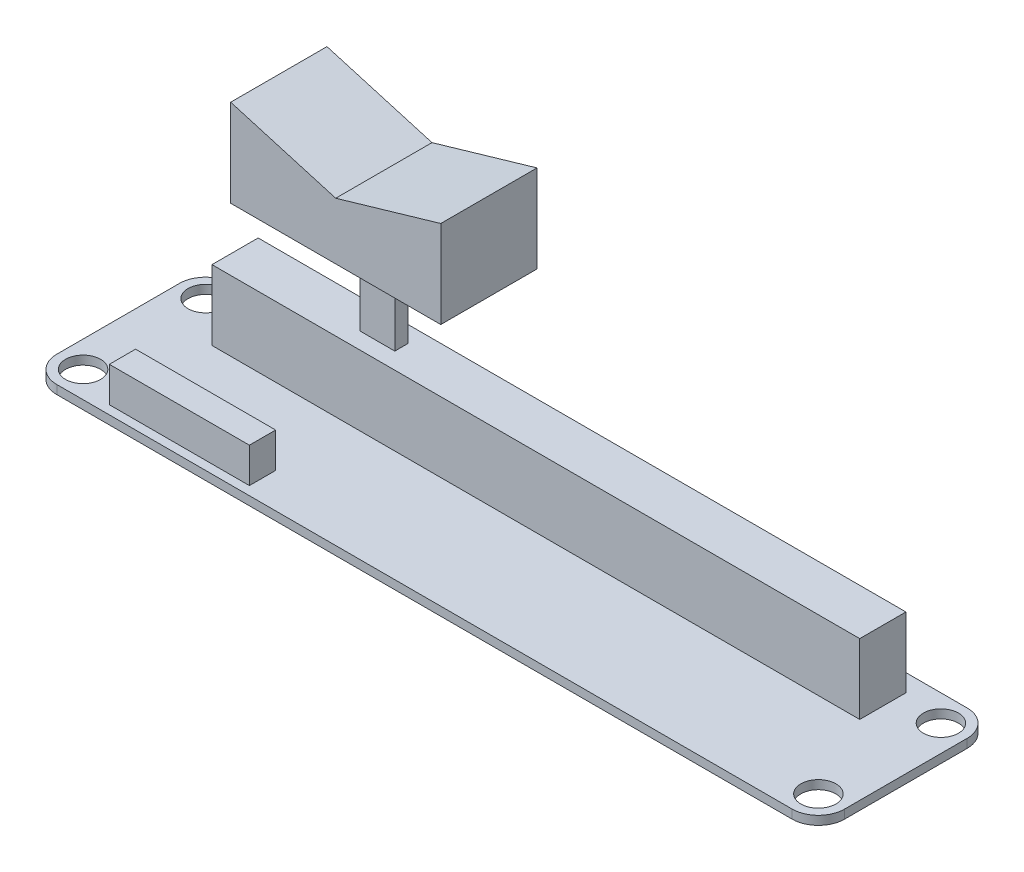
from build123d import *

# Parameters (mm, degrees)
SKETCH1_W           = 90
SKETCH1_H           = 20
BOSS_EXTRUDE1_DEPTH = 1
SKETCH2_R           = 2
CUT_EXTRUDE1_DEPTH  = 93.200867675
FILLET1_R           = 3
SKETCH3_W           = 74
SKETCH3_H           = 5.275339083
BOSS_EXTRUDE2_DEPTH = 8
SKETCH4_W           = 16
SKETCH4_H           = 3
BOSS_EXTRUDE3_DEPTH = 4
SKETCH5_W           = 4
SKETCH5_H           = 1.5
BOSS_EXTRUDE4_DEPTH = 10
SKETCH6_W           = 24
SKETCH6_H           = 11
BOSS_EXTRUDE5_DEPTH = 10
CUT_EXTRUDE2_DEPTH  = 96.194537658


with BuildPart() as part:
    # Sketch1 → Boss-Extrude1 (new body)
    with BuildSketch(Plane(origin=(0, 0, 0), x_dir=(1, 0, 0), z_dir=(0, 1, 0))):
        with Locations((45, 10)):
            Rectangle(SKETCH1_W, SKETCH1_H)
    extrude(amount=BOSS_EXTRUDE1_DEPTH)

    # Sketch2 → Cut-Extrude1 (cut, through all)
    with BuildSketch(Plane(origin=(0, 1, 0), x_dir=(1, 0, 0), z_dir=(0, 1, 0))):
        with Locations(Location((3, 17, 0), (0, 0, 270))):
            Circle(SKETCH2_R)
        with Locations(Location((87, 17, 0), (0, 0, 90))):
            Circle(SKETCH2_R)
        with Locations(Location((87, 3, 0), (0, 0, 270))):
            Circle(SKETCH2_R)
        with Locations(Location((3, 3, 0), (0, 0, 90))):
            Circle(SKETCH2_R)
    extrude(amount=-CUT_EXTRUDE1_DEPTH, mode=Mode.SUBTRACT)

    # Fillet1
    fillet1_edges = [part.edges().sort_by_distance(p)[0] for p in [
        (0, 0.5, -20),
        (90, 0.5, -20),
        (90, 0.5, 0),
        (0, 0.5, 0),
    ]]
    fillet(fillet1_edges, radius=FILLET1_R)

    # Sketch3 → Boss-Extrude2 (add)
    with BuildSketch(Plane(origin=(0, 1, 0), x_dir=(1, 0, 0), z_dir=(0, 1, 0))):
        with Locations((45, 15.362330459)):
            Rectangle(SKETCH3_W, SKETCH3_H)
    extrude(amount=BOSS_EXTRUDE2_DEPTH)

    # Sketch4 → Boss-Extrude3 (add)
    with BuildSketch(Plane(origin=(0, 1, 0), x_dir=(1, 0, 0), z_dir=(0, 1, 0))):
        with Locations((16, 2.5)):
            Rectangle(SKETCH4_W, SKETCH4_H)
    extrude(amount=BOSS_EXTRUDE3_DEPTH)

    # Sketch5 → Boss-Extrude4 (add)
    with BuildSketch(Plane(origin=(0, 9, 0), x_dir=(1, 0, 0), z_dir=(0, 1, 0))):
        with Locations((25, 15.362330459)):
            Rectangle(SKETCH5_W, SKETCH5_H)
    extrude(amount=BOSS_EXTRUDE4_DEPTH)

    # Sketch6 → Boss-Extrude5 (add)
    with BuildSketch(Plane(origin=(0, 19, 0), x_dir=(1, 0, 0), z_dir=(0, 1, 0))):
        with Locations((25, 15.362330459)):
            Rectangle(SKETCH6_W, SKETCH6_H)
    extrude(amount=BOSS_EXTRUDE5_DEPTH)

    # Sketch7 → Cut-Extrude2 (cut, through all)
    with BuildSketch(Plane.XY.offset(-9.862330459)):
        Polygon((37, 29), (25, 25.5), (13, 29), align=None)
    extrude(amount=-CUT_EXTRUDE2_DEPTH, mode=Mode.SUBTRACT)


solid = part.part
